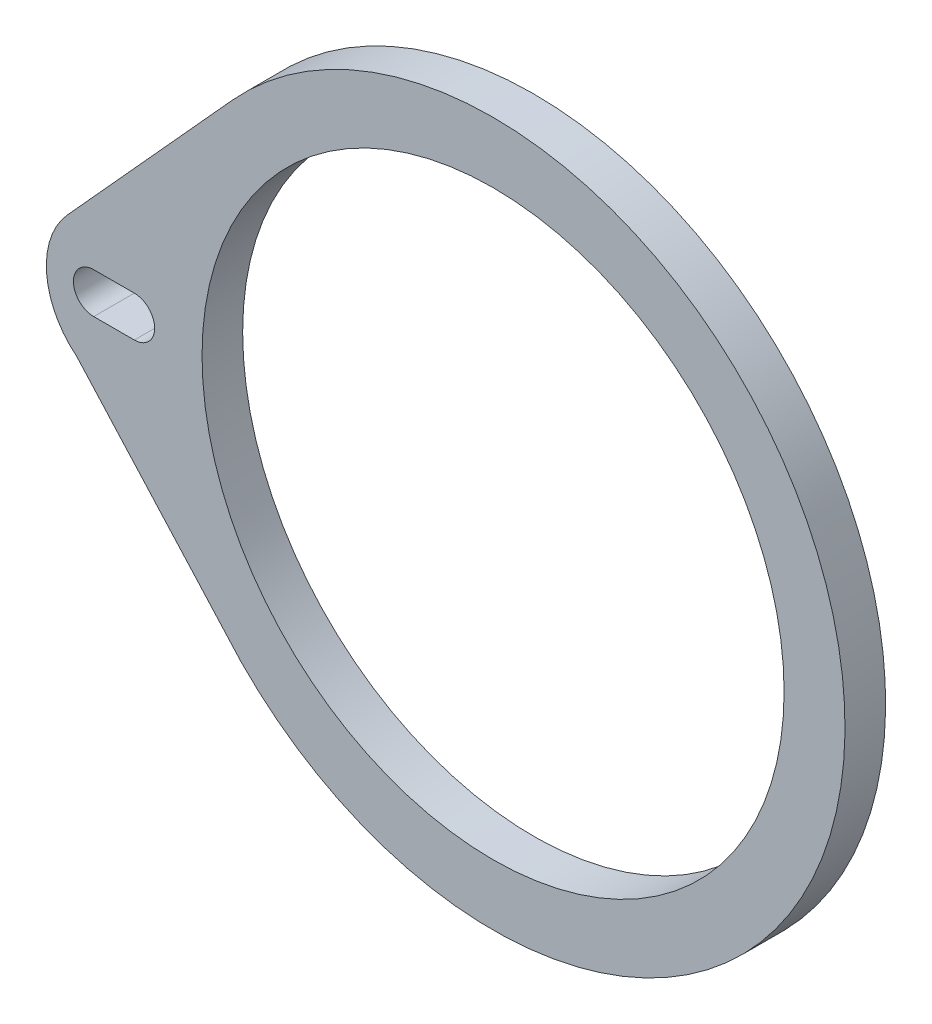
from build123d import *

# Parameters (mm, degrees)
EXTRUDE_1_DEPTH     = 3
SKETCH_2_R          = 21.5
CUT_EXTRUDE_1_DEPTH = 10


with BuildPart() as part:
    # 스케치1 → 보스-돌출1 (new body)
    with BuildSketch(Plane.XY):
        with BuildLine():
            Line((-19.259259259, 17.466566142), (-31.444444444, 4.030746033))
            ThreePointArc((-31.444444444, 4.030746033), (-32.981389073, -0.472212618), (-30.756898072, -4.678217276))
            Line((-30.756898072, -4.678217276), (-18.61420291, -18.152450249))
            ThreePointArc((-18.61420291, -18.152450249), (25.995737465, 0.470779859), (-19.259259259, 17.466566142))
        make_face()
    extrude(amount=EXTRUDE_1_DEPTH)

    # 스케치2 → 컷-돌출1 (cut)
    with BuildSketch(Plane(origin=(0, 0, 0), x_dir=(-1, 0, 0), z_dir=(0, 0, -1))):
        Circle(SKETCH_2_R)
        with BuildLine():
            Line((26.5, 1.5), (29.5, 1.5))
            ThreePointArc((29.5, 1.5), (31, 0), (29.5, -1.5))
            Line((29.5, -1.5), (26.5, -1.5))
            ThreePointArc((26.5, -1.5), (25, 0), (26.5, 1.5))
        make_face()
    extrude(amount=-CUT_EXTRUDE_1_DEPTH, mode=Mode.SUBTRACT)


solid = part.part
